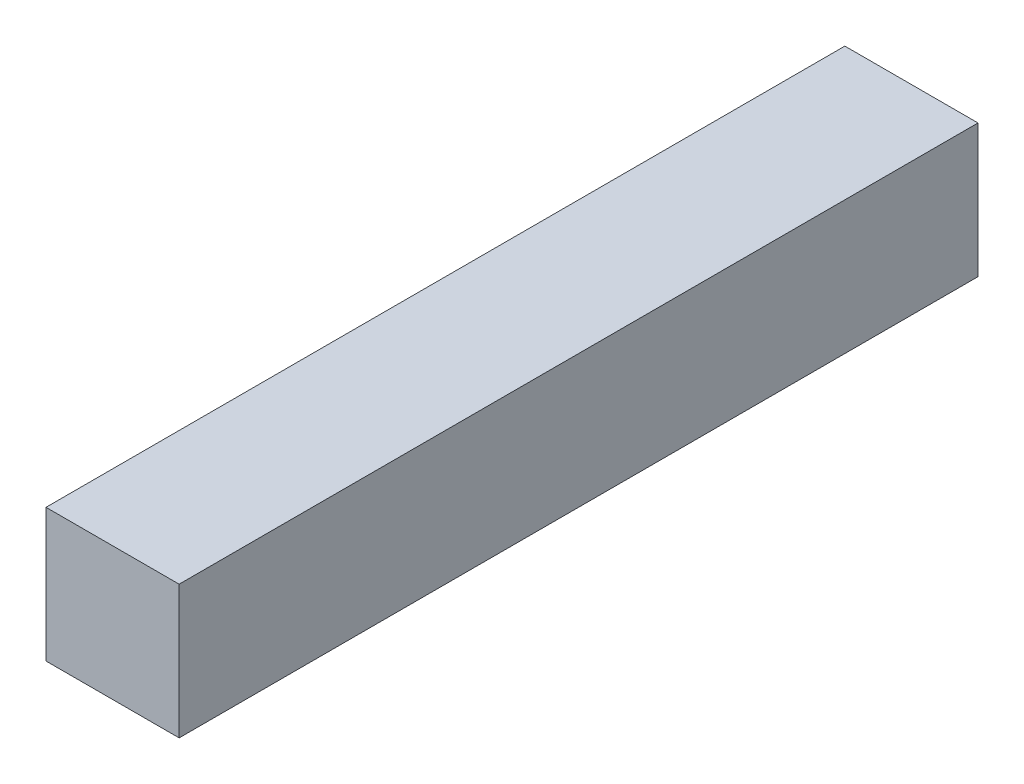
from build123d import *

# Parameters (mm, degrees)
SKETCH1_W           = 10
SKETCH1_H           = 10
BOSS_EXTRUDE1_DEPTH = 60
SKETCH3_W           = 3.7
SKETCH3_H           = 5.5
CUT_EXTRUDE1_DEPTH  = 5


with BuildPart() as part:
    # Sketch1 → Boss-Extrude1 (new body)
    with BuildSketch(Plane.XY):
        Rectangle(SKETCH1_W, SKETCH1_H)
    extrude(amount=BOSS_EXTRUDE1_DEPTH)

    # Sketch3 → Cut-Extrude1 (cut)
    with BuildSketch(Plane.XY):
        Rectangle(SKETCH3_W, SKETCH3_H)
    extrude(amount=CUT_EXTRUDE1_DEPTH, mode=Mode.SUBTRACT)


solid = part.part
